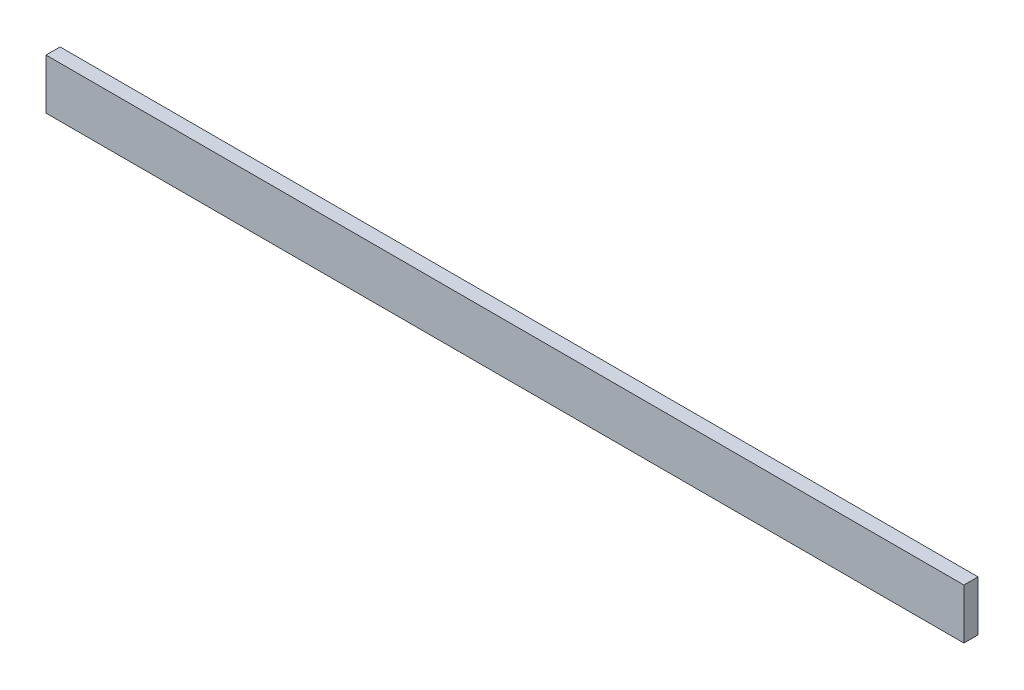
from build123d import *

# Parameters (mm, degrees)
SKETCH1_W           = 488.95
SKETCH1_H           = 25.4
BOSS_EXTRUDE1_DEPTH = 7.112
SKETCH2_W           = 25.4
SKETCH2_H           = 25.4
CUT_EXTRUDE1_DEPTH  = 490.660947028


with BuildPart() as part:
    # Sketch1 → Boss-Extrude1 (new body)
    with BuildSketch(Plane.XY):
        with Locations((244.475, 12.7)):
            Rectangle(SKETCH1_W, SKETCH1_H)
    extrude(amount=BOSS_EXTRUDE1_DEPTH)

    # Sketch2 → Cut-Extrude1 (cut, through all)
    with BuildSketch(Plane.XY):
        with Locations((12.7, 12.7)):
            Rectangle(SKETCH2_W, SKETCH2_H)
    extrude(amount=CUT_EXTRUDE1_DEPTH, mode=Mode.SUBTRACT)


solid = part.part
